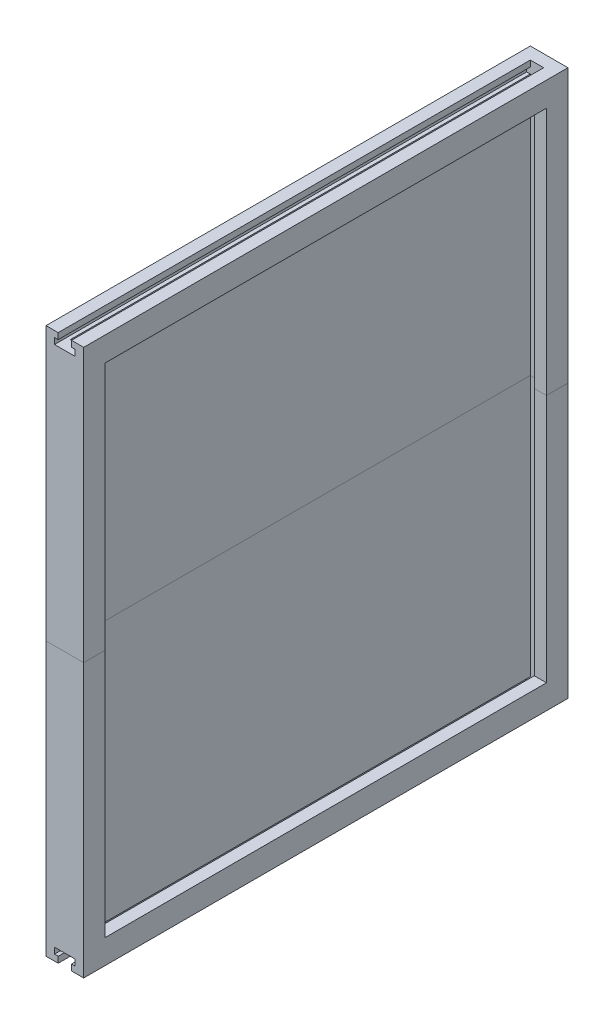
from build123d import *

# Parameters (mm, degrees)
SKETCH1_W              = 450
SKETCH1_H              = 399
BOSS_EXTRUDE1_DEPTH    = 10
SKETCH3_W              = 450
SKETCH3_H              = 399
SKETCH3_W_2            = 430
SKETCH3_H_2            = 379
BOSS_EXTRUDE2_DEPTH    = 11
SKETCH5_W              = 450
SKETCH5_H              = 399
SKETCH5_W_2            = 410
SKETCH5_H_2            = 363.533333334
BOSS_EXTRUDE3_DEPTH    = 10
SKETCH7_W              = 11
SKETCH7_H              = 5
SKETCH7_W_2            = 17
CUT_EXTRUDE1_DEPTH     = 389
SPLIT1_SURFACE_1_BACK  = 603.214
SPLIT1_SURFACE_1_DEPTH = 1206.428
SPLIT1_SURFACE_2_BACK  = 603.214
SPLIT1_SURFACE_2_DEPTH = 1206.428


with BuildPart() as part:
    # Sketch1 → Boss-Extrude1 (new body)
    with BuildSketch(Plane.YZ):
        Rectangle(SKETCH1_W, SKETCH1_H)
    extrude(amount=BOSS_EXTRUDE1_DEPTH)

    # Sketch3 → Boss-Extrude2 (add)
    with BuildSketch(Plane.YZ.offset(10)):
        Rectangle(SKETCH3_W, SKETCH3_H)
        Rectangle(SKETCH3_W_2, SKETCH3_H_2, mode=Mode.SUBTRACT)
    extrude(amount=BOSS_EXTRUDE2_DEPTH)

    # Sketch5 → Boss-Extrude3 (add)
    with BuildSketch(Plane.YZ.offset(21)):
        Rectangle(SKETCH5_W, SKETCH5_H)
        Rectangle(SKETCH5_W_2, SKETCH5_H_2, mode=Mode.SUBTRACT)
    extrude(amount=BOSS_EXTRUDE3_DEPTH)

    # Sketch7 → Cut-Extrude1 (cut)
    with BuildSketch(Plane.XY.offset(199.5)):
        with Locations((15.5, -222.5)):
            Rectangle(SKETCH7_W, SKETCH7_H)
        Polygon((7, -220), (10, -220), (21, -220), (24, -220), (24, -215), (7, -215), align=None)
        with Locations((15.5, 222.5)):
            Rectangle(SKETCH7_W, SKETCH7_H)
        with Locations((15.5, 217.5)):
            Rectangle(SKETCH7_W_2, SKETCH7_H)
    extrude(amount=-CUT_EXTRUDE1_DEPTH, mode=Mode.SUBTRACT)


with BuildPart() as body_2:
    # Split1: the piece behind the surface
    add(part.part)
    # Split1 surface: a surface, the sketch's curves swept straight by 1206.428 mm
    with BuildLine(Plane.XY.offset(199.5).offset(-SPLIT1_SURFACE_1_BACK), mode=Mode.PRIVATE) as split1_surface_1_path:
        Line((0, 0), (31, 0))
    split1_surface_1 = Shell.extrude(split1_surface_1_path.wire(), (0 * SPLIT1_SURFACE_1_DEPTH, 0 * SPLIT1_SURFACE_1_DEPTH, 1 * SPLIT1_SURFACE_1_DEPTH))
    split(bisect_by=split1_surface_1, keep=Keep.BOTTOM)


with BuildPart() as part_1:
    add(part.part)

    # Split1: split by a surface, the side it looks to stays
    # Split1 surface: a surface, the sketch's curves swept straight by 1206.428 mm
    with BuildLine(Plane.XY.offset(199.5).offset(-SPLIT1_SURFACE_2_BACK), mode=Mode.PRIVATE) as split1_surface_2_path:
        Line((0, 0), (31, 0))
    split1_surface_2 = Shell.extrude(split1_surface_2_path.wire(), (0 * SPLIT1_SURFACE_2_DEPTH, 0 * SPLIT1_SURFACE_2_DEPTH, 1 * SPLIT1_SURFACE_2_DEPTH))
    split(bisect_by=split1_surface_2, keep=Keep.TOP)


solid = Compound([body_2.part, part_1.part])
